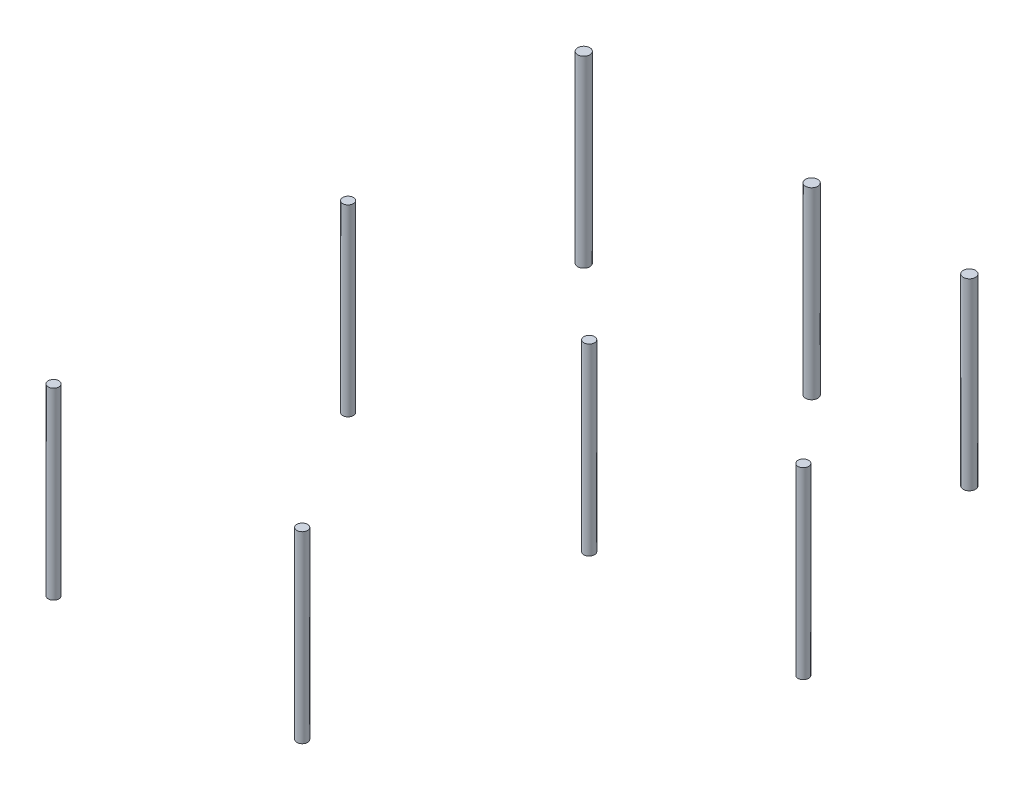
from build123d import *

# Parameters (mm, degrees)
ESBO_O2_R                  = 8
RESSALTO_EXTRUS_O2_DEPTH   = 240
RESSALTO_EXTRUS_O2_2_DEPTH = 240
RESSALTO_EXTRUS_O2_3_DEPTH = 240
ESBO_O6_R                  = 7
RESSALTO_EXTRUS_O3_DEPTH   = 240
RESSALTO_EXTRUS_O3_2_DEPTH = 240
RESSALTO_EXTRUS_O3_3_DEPTH = 240
ESBO_O7_R                  = 7
RESSALTO_EXTRUS_O4_DEPTH   = 240
RESSALTO_EXTRUS_O4_2_DEPTH = 240


with BuildPart() as part:
    # Esboço2 → Ressalto-extrusão2 (new body)
    with BuildSketch(Plane(origin=(0, 30, 0), x_dir=(1, 0, 0), z_dir=(0, 1, 0))):
        with Locations(Location((0, 693.016670883, 0), (0, 0, 270))):
            Circle(ESBO_O2_R)
    extrude(amount=RESSALTO_EXTRUS_O2_DEPTH)


with BuildPart() as body_2:
    # Esboço2 → Ressalto-extrus_o2 2 (new body)
    with BuildSketch(Plane(origin=(0, 30, 0), x_dir=(1, 0, 0), z_dir=(0, 1, 0))):
        with Locations(Location((297.870449082, 693.016670883, 0), (0, 0, 270))):
            Circle(ESBO_O2_R)
    extrude(amount=RESSALTO_EXTRUS_O2_2_DEPTH)


with BuildPart() as body_3:
    # Esboço2 → Ressalto-extrus_o2 3 (new body)
    with BuildSketch(Plane(origin=(0, 30, 0), x_dir=(1, 0, 0), z_dir=(0, 1, 0))):
        with Locations(Location((504, 693.016670883, 0), (0, 0, 270))):
            Circle(ESBO_O2_R)
    extrude(amount=RESSALTO_EXTRUS_O2_3_DEPTH)


with BuildPart() as body_4:
    # Esboço6 → Ressalto-extrusão3 (new body)
    with BuildSketch(Plane(origin=(0, 15, 0), x_dir=(1, 0, 0), z_dir=(0, 1, 0))):
        with Locations(Location((0, 385, 0), (0, 0, 270))):
            Circle(ESBO_O6_R)
    extrude(amount=RESSALTO_EXTRUS_O3_DEPTH)


with BuildPart() as body_5:
    # Esboço6 → Ressalto-extrus_o3 2 (new body)
    with BuildSketch(Plane(origin=(0, 15, 0), x_dir=(1, 0, 0), z_dir=(0, 1, 0))):
        with Locations(Location((315.148251138, 385, 0), (0, 0, 270))):
            Circle(ESBO_O6_R)
    extrude(amount=RESSALTO_EXTRUS_O3_2_DEPTH)


with BuildPart() as body_6:
    # Esboço6 → Ressalto-extrus_o3 3 (new body)
    with BuildSketch(Plane(origin=(0, 15, 0), x_dir=(1, 0, 0), z_dir=(0, 1, 0))):
        with Locations(Location((595, 385, 0), (0, 0, 270))):
            Circle(ESBO_O6_R)
    extrude(amount=RESSALTO_EXTRUS_O3_3_DEPTH)


with BuildPart() as body_7:
    # Esboço7 → Ressalto-extrusão4 (new body)
    with BuildSketch(Plane(origin=(0, 0, 0), x_dir=(1, 0, 0), z_dir=(0, 1, 0))):
        with Locations(Location((0, 0, 0), (0, 0, 270))):
            Circle(ESBO_O7_R)
    extrude(amount=RESSALTO_EXTRUS_O4_DEPTH)


with BuildPart() as body_8:
    # Esboço7 → Ressalto-extrus_o4 2 (new body)
    with BuildSketch(Plane(origin=(0, 0, 0), x_dir=(1, 0, 0), z_dir=(0, 1, 0))):
        with Locations(Location((325, 0, 0), (0, 0, 270))):
            Circle(ESBO_O7_R)
    extrude(amount=RESSALTO_EXTRUS_O4_2_DEPTH)


solid = Compound([part.part, body_2.part, body_3.part, body_4.part, body_5.part, body_6.part, body_7.part, body_8.part])
